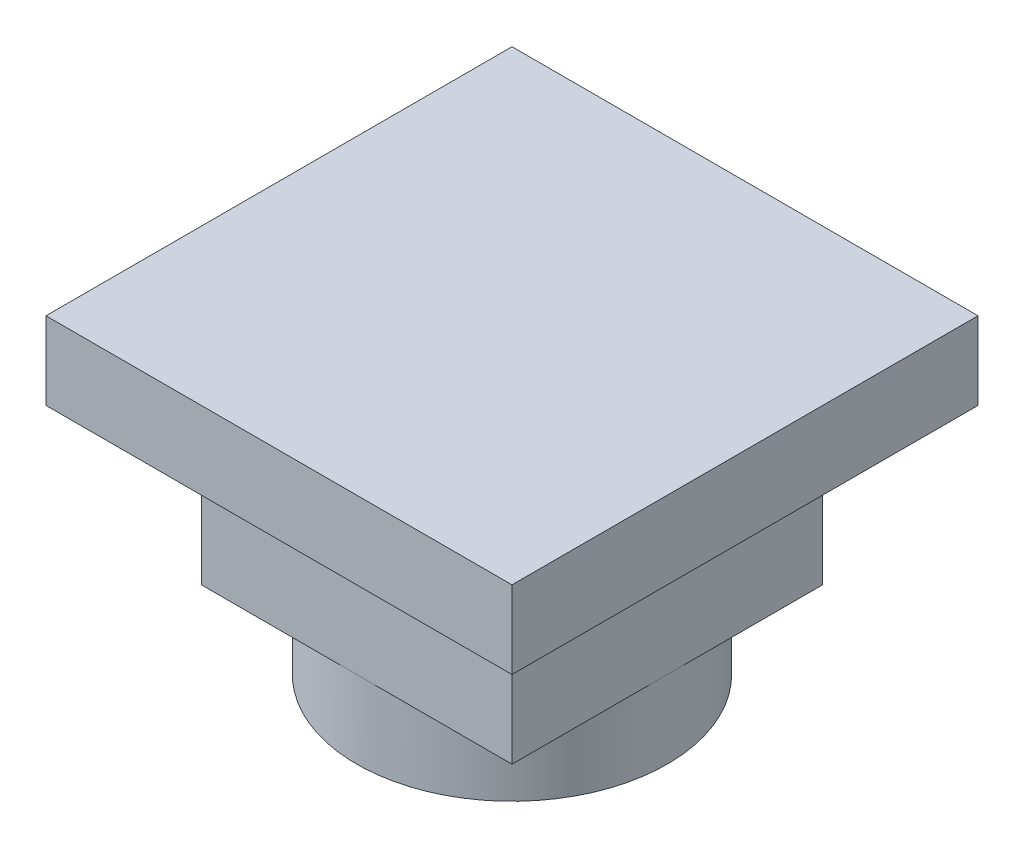
from build123d import *

# Parameters (mm, degrees)
SKETCH1_W           = 1
SKETCH1_H           = 1
BOSS_EXTRUDE1_DEPTH = 0.5
SKETCH2_W           = 1.5
SKETCH2_H           = 1.5
BOSS_EXTRUDE2_DEPTH = 0.25
SKETCH3_R           = 0.5
BOSS_EXTRUDE3_DEPTH = 0.25
SCALE1_SCALE        = 6


with BuildPart() as part:
    # Sketch1 → Boss-Extrude1 (new body)
    with BuildSketch(Plane(origin=(0, 0, 0), x_dir=(1, 0, 0), z_dir=(0, 1, 0))):
        Rectangle(SKETCH1_W, SKETCH1_H)
    extrude(amount=BOSS_EXTRUDE1_DEPTH)

    # Sketch2 → Boss-Extrude2 (add)
    with BuildSketch(Plane(origin=(0, 0.5, 0), x_dir=(1, 0, 0), z_dir=(0, 1, 0))):
        Rectangle(SKETCH2_W, SKETCH2_H)
    extrude(amount=BOSS_EXTRUDE2_DEPTH)

    # Sketch3 → Boss-Extrude3 (add)
    with BuildSketch(Plane.XZ):
        with Locations(Location((0, 0, 0), (0, 0, 270))):
            Circle(SKETCH3_R)
    extrude(amount=BOSS_EXTRUDE3_DEPTH)


with BuildPart() as part_1:
    # Scale1: scaled about (0, 0.359072941, 0)
    add(part.part.scale(SCALE1_SCALE).moved(Location((0, -1.795364705, 0))))


solid = part_1.part
